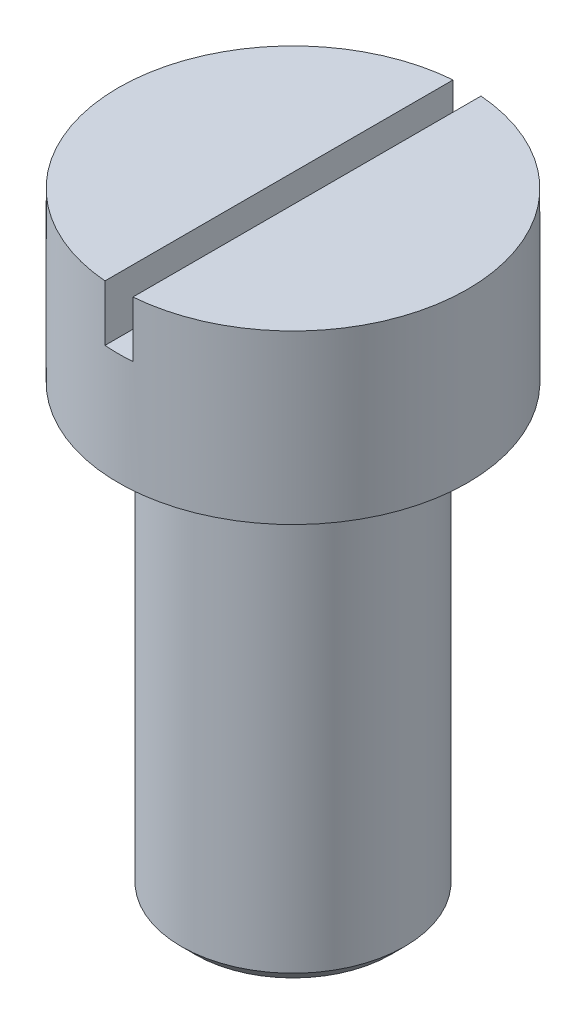
from build123d import *

# Parameters (mm, degrees)
CHAMFER1_SIZE      = 1
SKETCH6_W          = 2
SKETCH6_H          = 25
CUT_EXTRUDE1_DEPTH = 4


with BuildPart() as part:
    # Sketch2 → Revolve2 (revolve)
    with BuildSketch(Plane.XY, mode=Mode.PRIVATE) as revolve2_sk:
        Polygon((0, 0), (8, 0), (8, 32), (12.5, 32), (12.5, 44), (0, 44), align=None)
    revolve(revolve2_sk.sketch.rotate(Axis((0, 44, 0), (0, -1, 0)), 180), axis=Axis((0, 44, 0), (0, -1, 0)))

    # Chamfer1
    chamfer1_edges = [part.edges().sort_by_distance(p)[0] for p in [
        (8, 0, 0),
    ]]
    chamfer(chamfer1_edges, length=CHAMFER1_SIZE)

    # Sketch6 → Cut-Extrude1 (cut)
    with BuildSketch(Plane(origin=(0, 44, 0), x_dir=(1, 0, 0), z_dir=(0, 1, 0))):
        Rectangle(SKETCH6_W, SKETCH6_H)
    extrude(amount=-CUT_EXTRUDE1_DEPTH, mode=Mode.SUBTRACT)


solid = part.part
